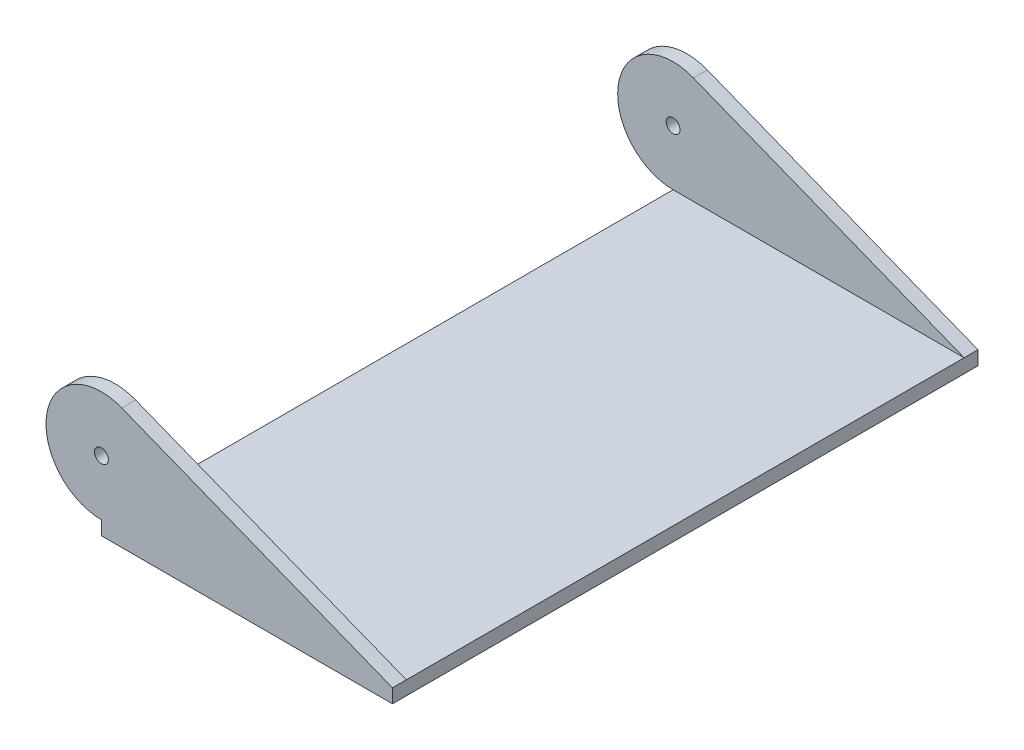
from build123d import *

# Parameters (mm, degrees)
SKETCH2_W           = 33.3375
SKETCH2_H           = 67.071875
BOSS_EXTRUDE1_DEPTH = 1.5875
SKETCH3_R           = 0.79375
BOSS_EXTRUDE2_DEPTH = 67.071875
SKETCH4_W           = 63.896875
SKETCH4_H           = 12.7
CUT_EXTRUDE1_DEPTH  = 95.294272092


with BuildPart() as part:
    # Sketch2 → Boss-Extrude1 (new body)
    with BuildSketch(Plane(origin=(0, 0, 0), x_dir=(1, 0, 0), z_dir=(0, 1, 0))):
        with Locations((-8.563888889, 50.797800926)):
            Rectangle(SKETCH2_W, SKETCH2_H)
    extrude(amount=BOSS_EXTRUDE1_DEPTH)

    # Sketch3 → Boss-Extrude2 (add)
    with BuildSketch(Plane.XY.offset(-17.261863426)):
        with BuildLine():
            Line((-25.232638889, 1.5875), (8.104861111, 1.5875))
            Line((8.104861111, 1.5875), (-22.898284403, 13.84286105))
            ThreePointArc((-22.898284403, 13.84286105), (-31.470488786, 9.125661885), (-25.232638889, 1.5875))
        make_face()
        with Locations((-25.232638889, 7.9375)):
            Circle(SKETCH3_R, mode=Mode.SUBTRACT)
    extrude(amount=-BOSS_EXTRUDE2_DEPTH)

    # Sketch4 → Cut-Extrude1 (cut, through all)
    with BuildSketch(Plane(origin=(8.104861111, 0, 0), x_dir=(0, 0, -1), z_dir=(1, 0, 0))):
        with Locations((50.797800926, 7.9375)):
            Rectangle(SKETCH4_W, SKETCH4_H)
    extrude(amount=-CUT_EXTRUDE1_DEPTH, mode=Mode.SUBTRACT)


solid = part.part
